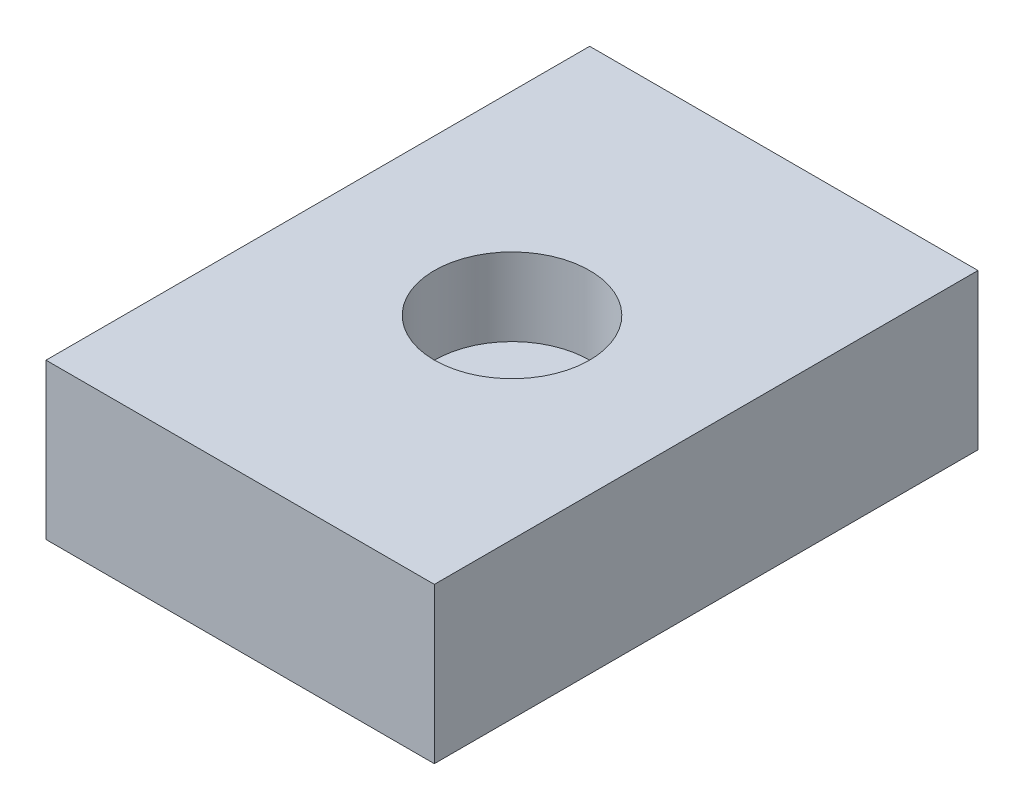
from build123d import *

# Parameters (mm, degrees)
SKETCH1_W           = 63.5
SKETCH1_H           = 88.9
BOSS_EXTRUDE1_DEPTH = 25.4
SKETCH3_R           = 12.7
CUT_EXTRUDE1_DEPTH  = 12.7


with BuildPart() as part:
    # Sketch1 → Boss-Extrude1 (new body)
    with BuildSketch(Plane(origin=(0, 0, 0), x_dir=(1, 0, 0), z_dir=(0, 1, 0))):
        Rectangle(SKETCH1_W, SKETCH1_H)
    extrude(amount=BOSS_EXTRUDE1_DEPTH)

    # Sketch3 → Cut-Extrude1 (cut)
    with BuildSketch(Plane(origin=(0, 25.4, 0), x_dir=(1, 0, 0), z_dir=(0, 1, 0))):
        Circle(SKETCH3_R)
    extrude(amount=-CUT_EXTRUDE1_DEPTH, mode=Mode.SUBTRACT)


solid = part.part
